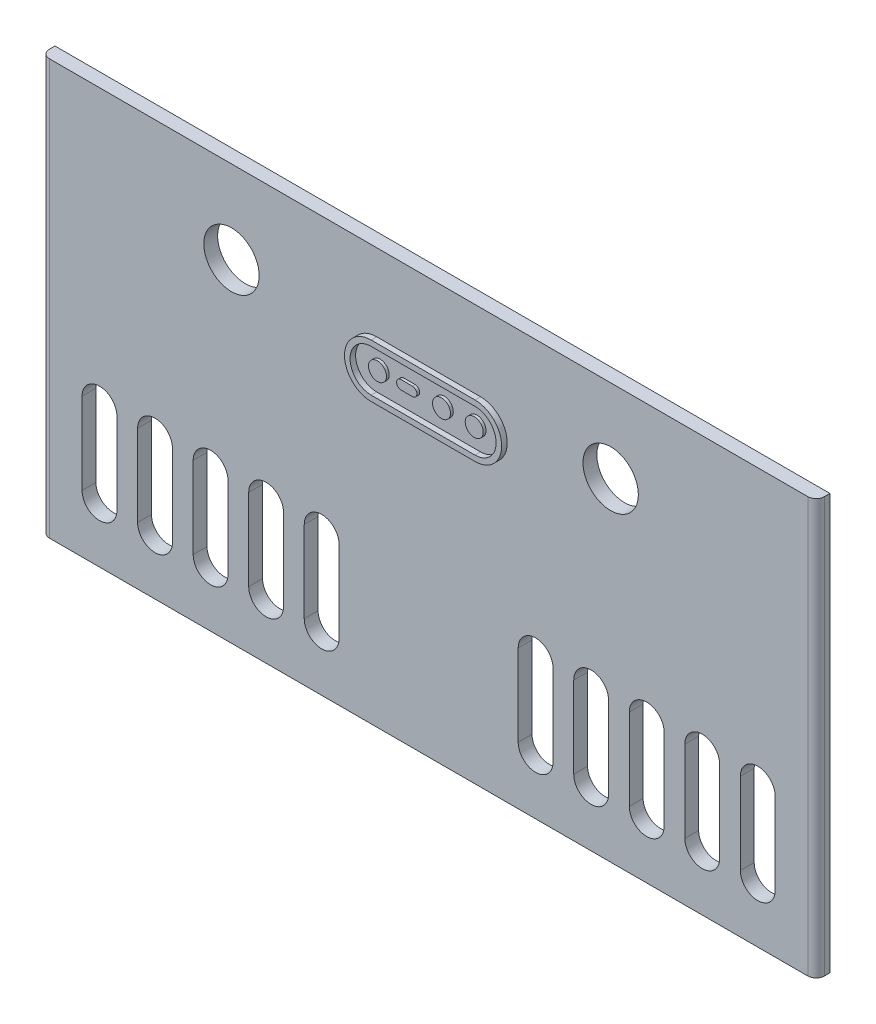
from build123d import *

# Parameters (mm, degrees)
SKETCH1_W           = 280
SKETCH1_H           = 150
BOSS_EXTRUDE1_DEPTH = 5
FILLET1_R           = 3
BOSS_EXTRUDE2_DEPTH = 2
SKETCH4_R           = 3.25
BOSS_EXTRUDE3_DEPTH = 1
CUT_EXTRUDE1_DEPTH  = 5
CUT_EXTRUDE2_REACH  = 160.902
SKETCH6_R           = 10


with BuildPart() as part:
    # Sketch1 → Boss-Extrude1 (new body)
    with BuildSketch(Plane.XY):
        Rectangle(SKETCH1_W, SKETCH1_H)
    extrude(amount=BOSS_EXTRUDE1_DEPTH)

    # Fillet1
    fillet1_edges = [part.edges().sort_by_distance(p)[0] for p in [
        (140, 0, 5),
        (-140, 0, 5),
    ]]
    fillet(fillet1_edges, radius=FILLET1_R)

    # Sketch2 → Boss-Extrude2 (add)
    with BuildSketch(Plane.XY.offset(5)):
        with BuildLine():
            Line((-18.760224692, 47.124562697), (18.760224692, 47.124562697))
            ThreePointArc((18.760224692, 47.124562697), (28.384787389, 37.5), (18.760224692, 27.875437303))
            Line((18.760224692, 27.875437303), (-18.760224692, 27.875437303))
            ThreePointArc((-18.760224692, 27.875437303), (-28.384787389, 37.5), (-18.760224692, 47.124562697))
        make_face()
        with BuildLine():
            Line((-18.760224692, 45.124562697), (18.760224692, 45.124562697))
            ThreePointArc((18.760224692, 45.124562697), (26.384787389, 37.5), (18.760224692, 29.875437303))
            Line((18.760224692, 29.875437303), (-18.760224692, 29.875437303))
            ThreePointArc((-18.760224692, 29.875437303), (-26.384787389, 37.5), (-18.760224692, 45.124562697))
        make_face(mode=Mode.SUBTRACT)
    extrude(amount=BOSS_EXTRUDE2_DEPTH)

    # Sketch4 → Boss-Extrude3 (add)
    with BuildSketch(Plane.XY.offset(5)):
        with Locations((17.470523742, 37.5)):
            Circle(SKETCH4_R)
        with Locations((-17.4898287, 37.5)):
            Circle(SKETCH4_R)
        with Locations((5.652243355, 37.5)):
            Circle(SKETCH4_R)
        with BuildLine():
            Line((-8.935173859, 39.13468348), (-4.880366362, 39.13468348))
            ThreePointArc((-4.880366362, 39.13468348), (-3.245682882, 37.5), (-4.880366362, 35.86531652))
            Line((-4.880366362, 35.86531652), (-8.935173859, 35.86531652))
            ThreePointArc((-8.935173859, 35.86531652), (-10.569857339, 37.5), (-8.935173859, 39.13468348))
        make_face()
    extrude(amount=BOSS_EXTRUDE3_DEPTH)

    # Sketch5 → Cut-Extrude1 (cut)
    with BuildSketch(Plane.XY.offset(5)):
        with BuildLine():
            Line((125.208389031, -24.677314769), (125.208389031, -54.157596843))
            ThreePointArc((125.208389031, -54.157596843), (118.914845667, -60.451140207), (112.621302303, -54.157596843))
            Line((112.621302303, -54.157596843), (112.621302303, -24.677314769))
            ThreePointArc((112.621302303, -24.677314769), (118.914845667, -18.383771405), (125.208389031, -24.677314769))
        make_face()
        with BuildLine():
            Line((105.142389031, -24.677314769), (105.142389031, -54.157596843))
            ThreePointArc((105.142389031, -54.157596843), (98.848845667, -60.451140207), (92.555302303, -54.157596843))
            Line((92.555302303, -54.157596843), (92.555302303, -24.677314769))
            ThreePointArc((92.555302303, -24.677314769), (98.848845667, -18.383771405), (105.142389031, -24.677314769))
        make_face()
        with BuildLine():
            Line((85.076389031, -24.677314769), (85.076389031, -54.157596843))
            ThreePointArc((85.076389031, -54.157596843), (78.782845667, -60.451140207), (72.489302303, -54.157596843))
            Line((72.489302303, -54.157596843), (72.489302303, -24.677314769))
            ThreePointArc((72.489302303, -24.677314769), (78.782845667, -18.383771405), (85.076389031, -24.677314769))
        make_face()
        with BuildLine():
            Line((65.010389031, -24.677314769), (65.010389031, -54.157596843))
            ThreePointArc((65.010389031, -54.157596843), (58.716845667, -60.451140207), (52.423302303, -54.157596843))
            Line((52.423302303, -54.157596843), (52.423302303, -24.677314769))
            ThreePointArc((52.423302303, -24.677314769), (58.716845667, -18.383771405), (65.010389031, -24.677314769))
        make_face()
        with BuildLine():
            Line((44.944389031, -24.677314769), (44.944389031, -54.157596843))
            ThreePointArc((44.944389031, -54.157596843), (38.650845667, -60.451140207), (32.357302303, -54.157596843))
            Line((32.357302303, -54.157596843), (32.357302303, -24.677314769))
            ThreePointArc((32.357302303, -24.677314769), (38.650845667, -18.383771405), (44.944389031, -24.677314769))
        make_face()
    cut_extrude1 = extrude(amount=-CUT_EXTRUDE1_DEPTH, mode=Mode.SUBTRACT)

    # Mirror1: Cut-Extrude1 across plane
    add(cut_extrude1.mirror(Plane(origin=(0, 0, 0), x_dir=(0, 0, 1), z_dir=(1, 0, 0))), mode=Mode.SUBTRACT)

    # Sketch6 → Cut-Extrude2 (cut, up to next)
    with BuildSketch(Plane.XY.offset(5), mode=Mode.PRIVATE) as cut_extrude2_sk1:
        with Locations((65.764998976, 45)):
            Circle(SKETCH6_R)
    cut_extrude2_tool1 = extrude(cut_extrude2_sk1.sketch, amount=-CUT_EXTRUDE2_REACH, mode=Mode.PRIVATE) & part.part
    # Sketch6 → Cut-Extrude2 (cut, up to next)
    with BuildSketch(Plane.XY.offset(5), mode=Mode.PRIVATE) as cut_extrude2_sk2:
        with Locations((-71.235001024, 45)):
            Circle(SKETCH6_R)
    cut_extrude2_tool2 = extrude(cut_extrude2_sk2.sketch, amount=-CUT_EXTRUDE2_REACH, mode=Mode.PRIVATE) & part.part
    add(cut_extrude2_tool1.solids().sort_by_distance((65.764999, 45, 5))[0], mode=Mode.SUBTRACT)
    add(cut_extrude2_tool2.solids().sort_by_distance((-71.235001, 45, 5))[0], mode=Mode.SUBTRACT)


solid = part.part
